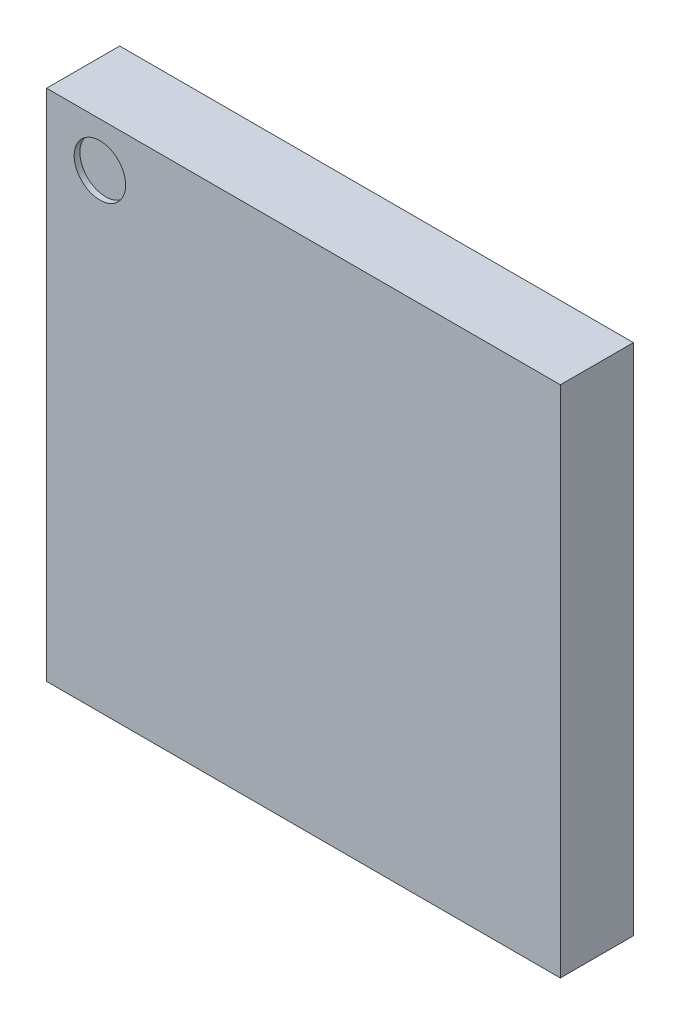
from build123d import *

# Parameters (mm, degrees)
BOSS_EXTRUDE1_START  = 0.11
SKETCH1_W            = 4.5
SKETCH1_H            = 4.5
BOSS_EXTRUDE1_DEPTH  = 0.64
LPATTERN1_COUNT      = 9
LPATTERN1_PITCH      = 0.5
LPATTERN1_COUNT_DIR2 = 9
LPATTERN1_PITCH_DIR2 = 0.5
SKETCH3_R            = 0.225332011
CUT_EXTRUDE1_DEPTH   = 0.05


with BuildPart() as part:
    # Sketch1 → Boss-Extrude1 (new body)
    with BuildSketch(Plane.XY.offset(BOSS_EXTRUDE1_START)):
        Rectangle(SKETCH1_W, SKETCH1_H)
    extrude(amount=BOSS_EXTRUDE1_DEPTH)

    # Sketch2 → Revolve1 (revolve)
    with BuildSketch(Plane(origin=(0, 2, 0), x_dir=(1, 0, 0), z_dir=(0, 1, 0))):
        with BuildLine():
            Line((-2, -0.125), (-2, 0))
            ThreePointArc((-2, 0), (-1.911611652, -0.036611652), (-1.875, -0.125))
            Line((-1.875, -0.125), (-2, -0.125))
        make_face()
    revolve1 = revolve(axis=Axis((-2, 2, 0.125), (0, 0, -1)))

    # LPattern1: Revolve1 9 × 9
    with Locations(*[(i * LPATTERN1_PITCH, -j * LPATTERN1_PITCH_DIR2, 0) for i in range(LPATTERN1_COUNT) for j in range(LPATTERN1_COUNT_DIR2) if (i, j) != (0, 0)]):
        add(revolve1)

    # Sketch3 → Cut-Extrude1 (cut)
    with BuildSketch(Plane.XY.offset(0.75)):
        with Locations((-1.783057329, 1.860144394)):
            Circle(SKETCH3_R)
    extrude(amount=-CUT_EXTRUDE1_DEPTH, mode=Mode.SUBTRACT)


solid = part.part
